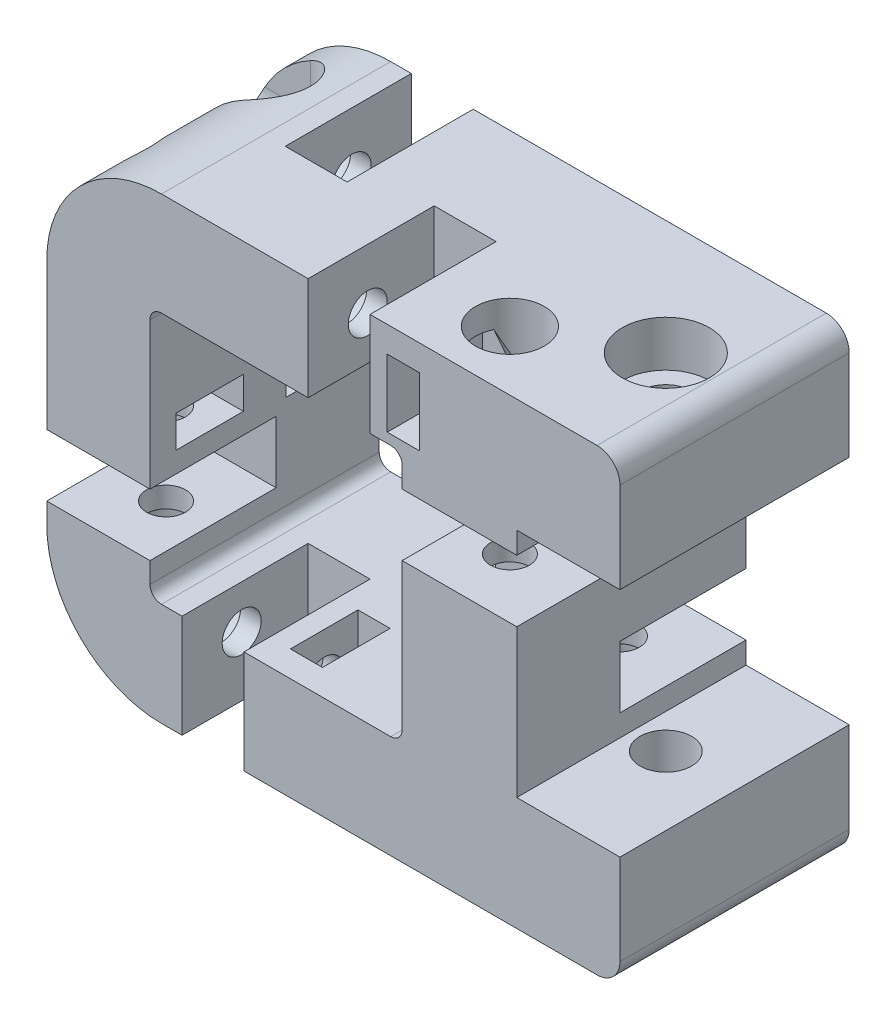
from build123d import *

# Parameters (mm, degrees)
SALIENTE_EXTRUIR1_DEPTH = 20
CROQUIS2_W              = 9
CROQUIS2_H              = 5.4
CROQUIS2_W_2            = 5.4
CROQUIS2_H_2            = 9
CROQUIS2_W_3            = 10
CORTAR_EXTRUIR1_DEPTH   = 11
CROQUIS3_W              = 5.4
CROQUIS3_H              = 9
CROQUIS3_W_2            = 9
CROQUIS3_H_2            = 5.4
CROQUIS3_W_3            = 10
CORTAR_EXTRUIR2_DEPTH   = 11
CROQUIS4_W              = 20
CROQUIS4_H              = 20.2
CORTAR_EXTRUIR3_DEPTH   = 9
CROQUIS5_R              = 2.25
CORTAR_EXTRUIR4_DEPTH   = 32
CROQUIS6_R              = 3.8
CORTAR_EXTRUIR5_DEPTH   = 4
CORTAR_EXTRUIR6_START   = -4
CROQUIS7_R              = 3.8
CORTAR_EXTRUIR6_DEPTH   = 4
CROQUIS8_R              = 1.7
CORTAR_EXTRUIR7_DEPTH   = 23
CROQUIS9_R              = 1.7
CORTAR_EXTRUIR8_DEPTH   = 34
CROQUIS10_R             = 3
CORTAR_EXTRUIR9_DEPTH   = 10
CROQUIS11_R             = 3
CORTAR_EXTRUIR10_DEPTH  = 21
CROQUIS12_R             = 1.7
CORTAR_EXTRUIR11_DEPTH  = 23
CROQUIS13_R             = 3
CORTAR_EXTRUIR12_DEPTH  = 10
CROQUIS14_W             = 6
CROQUIS14_H             = 6
CORTAR_EXTRUIR13_DEPTH  = 5.2
CROQUIS15_R             = 1.7
CORTAR_EXTRUIR14_DEPTH  = 23
CROQUIS16_R             = 3
CORTAR_EXTRUIR15_DEPTH  = 10
CROQUIS17_W             = 6
CROQUIS17_H             = 6
CORTAR_EXTRUIR16_DEPTH  = 5.2
CROQUIS18_R             = 1.7
CORTAR_EXTRUIR17_DEPTH  = 23
CROQUIS19_R             = 3
CORTAR_EXTRUIR18_DEPTH  = 10
CROQUIS20_R             = 1.7
CORTAR_EXTRUIR19_DEPTH  = 23
CROQUIS21_R             = 3
CORTAR_EXTRUIR20_DEPTH  = 10
CROQUIS22_W             = 2.8
CROQUIS22_H             = 5.9
CORTAR_EXTRUIR21_DEPTH  = 7.3
CROQUIS23_W             = 5.9
CROQUIS23_H             = 2.8
CORTAR_EXTRUIR22_DEPTH  = 7.3
CROQUIS24_W             = 5.9
CROQUIS24_H             = 2.8
CORTAR_EXTRUIR23_DEPTH  = 7.3
CROQUIS25_W             = 2.8
CROQUIS25_H             = 5.9
CORTAR_EXTRUIR24_DEPTH  = 7.3
CROQUIS26_W             = 2.8
CROQUIS26_H             = 5.9
CORTAR_EXTRUIR25_DEPTH  = 8.3
CROQUIS27_W             = 2.8
CROQUIS27_H             = 5.9
CORTAR_EXTRUIR26_DEPTH  = 8.3
CORTAR_EXTRUIR27_DEPTH  = 3


with BuildPart() as part:
    # Croquis1 → Saliente-Extruir1 (new body)
    # profile 1 of 2: a face of its own
    with BuildSketch(Plane.XY):
        with BuildLine():
            Line((-10, 20), (10, 20))
            ThreePointArc((10, 20), (17.071067812, 17.071067812), (20, 10))
            Line((20, 10), (20, -10))
            ThreePointArc((20, -10), (17.071067812, -17.071067812), (10, -20))
            Line((10, -20), (-10, -20))
            ThreePointArc((-10, -20), (-17.071067812, -17.071067812), (-20, -10))
            Line((-20, -10), (-20, 10))
            ThreePointArc((-20, 10), (-17.071067812, 17.071067812), (-10, 20))
        make_face()
        with BuildLine():
            ThreePointArc((-10, 11), (-10.707106781, 10.707106781), (-11, 10))
            Line((-11, 10), (-11, -10))
            ThreePointArc((-11, -10), (-10.707106781, -10.707106781), (-10, -11))
            Line((-10, -11), (10, -11))
            ThreePointArc((10, -11), (10.707106781, -10.707106781), (11, -10))
            Line((11, -10), (11, 10))
            ThreePointArc((11, 10), (10.707106781, 10.707106781), (10, 11))
            Line((10, 11), (-10, 11))
        make_face(mode=Mode.SUBTRACT)
    # profile 2 of 2: a face of its own
    with BuildSketch(Plane.XY):
        with BuildLine():
            Line((30, 18), (30, -18))
            ThreePointArc((30, -18), (29.414213562, -19.414213562), (28, -20))
            Line((28, -20), (10, -20))
            ThreePointArc((10, -20), (17.071067812, -17.071067812), (20, -10))
            Line((20, -10), (20, 10))
            ThreePointArc((20, 10), (17.071067812, 17.071067812), (10, 20))
            Line((10, 20), (28, 20))
            ThreePointArc((28, 20), (29.414213562, 19.414213562), (30, 18))
        make_face()
    extrude(amount=SALIENTE_EXTRUIR1_DEPTH)

    # Croquis2 → Cortar-Extruir1 (cut)
    with BuildSketch(Plane.XY.offset(20)):
        with Locations((-15.5, -5.5)):
            Rectangle(CROQUIS2_W, CROQUIS2_H)
        with Locations((-5.5, -15.5)):
            Rectangle(CROQUIS2_W_2, CROQUIS2_H_2)
        with Locations((16, 5.5)):
            Rectangle(CROQUIS2_W_3, CROQUIS2_H)
        with Locations((5.5, 15.5)):
            Rectangle(CROQUIS2_W_2, CROQUIS2_H_2)
    extrude(amount=-CORTAR_EXTRUIR1_DEPTH, mode=Mode.SUBTRACT)

    # Croquis3 → Cortar-Extruir2 (cut)
    with BuildSketch(Plane(origin=(0, 0, 0), x_dir=(-1, 0, 0), z_dir=(0, 0, -1))):
        with Locations((5.5, 15.5)):
            Rectangle(CROQUIS3_W, CROQUIS3_H)
        with Locations((15.5, 5.5)):
            Rectangle(CROQUIS3_W_2, CROQUIS3_H_2)
        with Locations((-5.5, -15.5)):
            Rectangle(CROQUIS3_W, CROQUIS3_H)
        with Locations((-16, -5.5)):
            Rectangle(CROQUIS3_W_3, CROQUIS3_H_2)
    extrude(amount=-CORTAR_EXTRUIR2_DEPTH, mode=Mode.SUBTRACT)

    # Croquis4 → Cortar-Extruir3 (cut)
    with BuildSketch(Plane(origin=(30, 0, 0), x_dir=(0, 0, -1), z_dir=(1, 0, 0))):
        with Locations((-10, 0)):
            Rectangle(CROQUIS4_W, CROQUIS4_H)
    extrude(amount=-CORTAR_EXTRUIR3_DEPTH, mode=Mode.SUBTRACT)

    # Croquis5 → Cortar-Extruir4 (cut, symmetric)
    with BuildSketch(Plane(origin=(0, -10.1, 0), x_dir=(1, 0, 0), z_dir=(0, 1, 0))):
        with Locations(Location((24, -10, 0), (0, 0, 270))):
            Circle(CROQUIS5_R)
    extrude(amount=CORTAR_EXTRUIR4_DEPTH, both=True, mode=Mode.SUBTRACT)

    # Croquis6 → Cortar-Extruir5 (cut)
    with BuildSketch(Plane(origin=(0, 20, 0), x_dir=(1, 0, 0), z_dir=(0, 1, 0))):
        with Locations(Location((24, -10, 0), (0, 0, 270))):
            Circle(CROQUIS6_R)
    extrude(amount=-CORTAR_EXTRUIR5_DEPTH, mode=Mode.SUBTRACT)

    # Croquis7 → Cortar-Extruir6 (cut)
    with BuildSketch(Plane.XZ.offset(20).offset(CORTAR_EXTRUIR6_START)):
        with Locations(Location((24, 10, 0), (0, 0, 90))):
            Circle(CROQUIS7_R)
    extrude(amount=CORTAR_EXTRUIR6_DEPTH, mode=Mode.SUBTRACT)

    # Croquis8 → Cortar-Extruir7 (cut)
    with BuildSketch(Plane.ZY.offset(20)):
        with Locations((5.2, 14.8)):
            Circle(CROQUIS8_R)
        with Locations((14.8, 14.8)):
            Circle(CROQUIS8_R)
        with Locations((5.2, -14.8)):
            Circle(CROQUIS8_R)
        with Locations((14.8, -14.8)):
            Circle(CROQUIS8_R)
    extrude(amount=-CORTAR_EXTRUIR7_DEPTH, mode=Mode.SUBTRACT)

    # Croquis9 → Cortar-Extruir8 (cut)
    with BuildSketch(Plane.ZY.offset(20)):
        with Locations((14.8, 14.8)):
            Circle(CROQUIS9_R)
        with Locations((5.2, -14.8)):
            Circle(CROQUIS9_R)
    extrude(amount=-CORTAR_EXTRUIR8_DEPTH, mode=Mode.SUBTRACT)

    # Croquis10 → Cortar-Extruir9 (cut)
    with BuildSketch(Plane.ZY.offset(20)):
        with Locations((5.2, 14.8)):
            Circle(CROQUIS10_R)
        with Locations((14.8, 14.8)):
            Circle(CROQUIS10_R)
        with Locations((14.8, -14.8)):
            Circle(CROQUIS10_R)
        with Locations((5.2, -14.8)):
            Circle(CROQUIS10_R)
    extrude(amount=-CORTAR_EXTRUIR9_DEPTH, mode=Mode.SUBTRACT)

    # Croquis11 → Cortar-Extruir10 (cut)
    with BuildSketch(Plane.ZY.offset(20)):
        with Locations((14.8, 14.8)):
            Circle(CROQUIS11_R)
        with Locations((5.2, -14.8)):
            Circle(CROQUIS11_R)
    extrude(amount=-CORTAR_EXTRUIR10_DEPTH, mode=Mode.SUBTRACT)

    # Croquis12 → Cortar-Extruir11 (cut)
    with BuildSketch(Plane(origin=(0, 20, 0), x_dir=(1, 0, 0), z_dir=(0, 1, 0))):
        with Locations(Location((-14.8, -5.2, 0), (0, 0, 270))):
            Circle(CROQUIS12_R)
    extrude(amount=-CORTAR_EXTRUIR11_DEPTH, mode=Mode.SUBTRACT)

    # Croquis13 → Cortar-Extruir12 (cut)
    with BuildSketch(Plane(origin=(0, 20, 0), x_dir=(1, 0, 0), z_dir=(0, 1, 0))):
        with Locations(Location((-14.8, -5.2, 0), (0, 0, 270))):
            Circle(CROQUIS13_R)
    extrude(amount=-CORTAR_EXTRUIR12_DEPTH, mode=Mode.SUBTRACT)

    # Croquis14 → Cortar-Extruir13 (cut)
    with BuildSketch(Plane(origin=(0, 20, 0), x_dir=(1, 0, 0), z_dir=(0, 1, 0))):
        with Locations((-17.8, -5.2)):
            Rectangle(CROQUIS14_W, CROQUIS14_H)
    extrude(amount=-CORTAR_EXTRUIR13_DEPTH, mode=Mode.SUBTRACT)

    # Croquis15 → Cortar-Extruir14 (cut)
    with BuildSketch(Plane.XZ.offset(20)):
        with Locations(Location((-14.8, 14.8, 0), (0, 0, 270))):
            Circle(CROQUIS15_R)
    extrude(amount=-CORTAR_EXTRUIR14_DEPTH, mode=Mode.SUBTRACT)

    # Croquis16 → Cortar-Extruir15 (cut)
    with BuildSketch(Plane(origin=(0, -20, 0), x_dir=(-1, 0, 0), z_dir=(0, -1, 0))):
        with Locations(Location((14.8, -14.8, 0), (0, 0, 90))):
            Circle(CROQUIS16_R)
    extrude(amount=-CORTAR_EXTRUIR15_DEPTH, mode=Mode.SUBTRACT)

    # Croquis17 → Cortar-Extruir16 (cut)
    with BuildSketch(Plane.XZ.offset(20)):
        with Locations((-17.8, 14.8)):
            Rectangle(CROQUIS17_W, CROQUIS17_H)
    extrude(amount=-CORTAR_EXTRUIR16_DEPTH, mode=Mode.SUBTRACT)

    # Croquis18 → Cortar-Extruir17 (cut)
    with BuildSketch(Plane.XZ.offset(20)):
        with Locations(Location((15.2, 5.2, 0), (0, 0, 270))):
            Circle(CROQUIS18_R)
    extrude(amount=-CORTAR_EXTRUIR17_DEPTH, mode=Mode.SUBTRACT)

    # Croquis19 → Cortar-Extruir18 (cut)
    with BuildSketch(Plane(origin=(0, -20, 0), x_dir=(-1, 0, 0), z_dir=(0, -1, 0))):
        with Locations(Location((-15.2, -5.2, 0), (0, 0, 90))):
            Circle(CROQUIS19_R)
    extrude(amount=-CORTAR_EXTRUIR18_DEPTH, mode=Mode.SUBTRACT)

    # Croquis20 → Cortar-Extruir19 (cut)
    with BuildSketch(Plane(origin=(0, 20, 0), x_dir=(1, 0, 0), z_dir=(0, 1, 0))):
        with Locations(Location((15.2, -14.8, 0), (0, 0, 270))):
            Circle(CROQUIS20_R)
    extrude(amount=-CORTAR_EXTRUIR19_DEPTH, mode=Mode.SUBTRACT)

    # Croquis21 → Cortar-Extruir20 (cut)
    with BuildSketch(Plane(origin=(0, 20, 0), x_dir=(1, 0, 0), z_dir=(0, 1, 0))):
        with Locations(Location((15.2, -14.8, 0), (0, 0, 270))):
            Circle(CROQUIS21_R)
    extrude(amount=-CORTAR_EXTRUIR20_DEPTH, mode=Mode.SUBTRACT)

    # Croquis22 → Cortar-Extruir21 (cut)
    with BuildSketch(Plane(origin=(0, -11, 0), x_dir=(1, 0, 0), z_dir=(0, 1, 0))):
        with Locations((0.4, -14.8)):
            Rectangle(CROQUIS22_W, CROQUIS22_H)
    extrude(amount=-CORTAR_EXTRUIR21_DEPTH, mode=Mode.SUBTRACT)

    # Croquis23 → Cortar-Extruir22 (cut)
    with BuildSketch(Plane(origin=(-11, 0, 0), x_dir=(0, 0, -1), z_dir=(1, 0, 0))):
        with Locations((-14.8, 0.4)):
            Rectangle(CROQUIS23_W, CROQUIS23_H)
        with Locations((-5.2, -0.4)):
            Rectangle(CROQUIS23_W, CROQUIS23_H)
    extrude(amount=-CORTAR_EXTRUIR22_DEPTH, mode=Mode.SUBTRACT)

    # Croquis24 → Cortar-Extruir23 (cut)
    with BuildSketch(Plane.ZY.offset(-11)):
        with Locations((5.2, 0.4)):
            Rectangle(CROQUIS24_W, CROQUIS24_H)
        with Locations((14.8, -0.4)):
            Rectangle(CROQUIS24_W, CROQUIS24_H)
    extrude(amount=-CORTAR_EXTRUIR23_DEPTH, mode=Mode.SUBTRACT)

    # Croquis25 → Cortar-Extruir24 (cut)
    with BuildSketch(Plane.XZ.offset(-11)):
        with Locations((0.4, 5.2)):
            Rectangle(CROQUIS25_W, CROQUIS25_H)
    extrude(amount=-CORTAR_EXTRUIR24_DEPTH, mode=Mode.SUBTRACT)

    # Croquis26 → Cortar-Extruir25 (cut)
    with BuildSketch(Plane.XY.offset(20)):
        with Locations((11.1, 14.8)):
            Rectangle(CROQUIS26_W, CROQUIS26_H)
    extrude(amount=-CORTAR_EXTRUIR25_DEPTH, mode=Mode.SUBTRACT)

    # Croquis27 → Cortar-Extruir26 (cut)
    with BuildSketch(Plane(origin=(0, 0, 0), x_dir=(-1, 0, 0), z_dir=(0, 0, -1))):
        with Locations((-11.1, -14.8)):
            Rectangle(CROQUIS27_W, CROQUIS27_H)
    extrude(amount=-CORTAR_EXTRUIR26_DEPTH, mode=Mode.SUBTRACT)

    # Croquis28 → Cortar-Extruir27 (cut)
    with BuildSketch(Plane.ZY.offset(-12.5)):
        Polygon((6.507669683, -11.85), (7.8, -14.8), (6.507669683, -17.75), (3.892330317, -17.75), (2.6, -14.8), (3.892330317, -11.85), align=None)
        Polygon((13.492330317, 17.75), (12.2, 14.8), (13.492330317, 11.85), (16.107669683, 11.85), (17.4, 14.8), (16.107669683, 17.75), align=None)
    extrude(amount=-CORTAR_EXTRUIR27_DEPTH, mode=Mode.SUBTRACT)


solid = part.part
